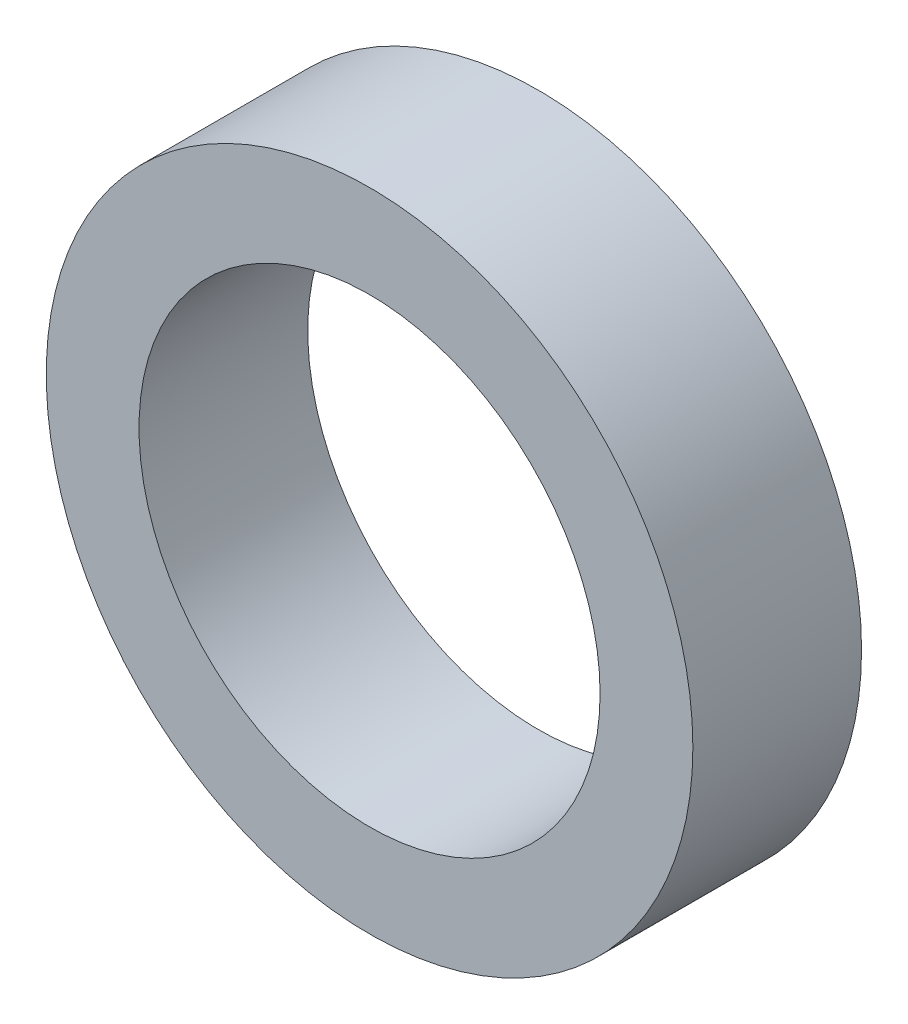
from build123d import *

# Parameters (mm, degrees)
SKETCH1_R           = 5.75
SKETCH1_R_2         = 4.1
BOSS_EXTRUDE1_DEPTH = 3


with BuildPart() as part:
    # Sketch1 → Boss-Extrude1 (new body)
    with BuildSketch(Plane.XY):
        Circle(SKETCH1_R)
        Circle(SKETCH1_R_2, mode=Mode.SUBTRACT)
    extrude(amount=BOSS_EXTRUDE1_DEPTH)


solid = part.part
